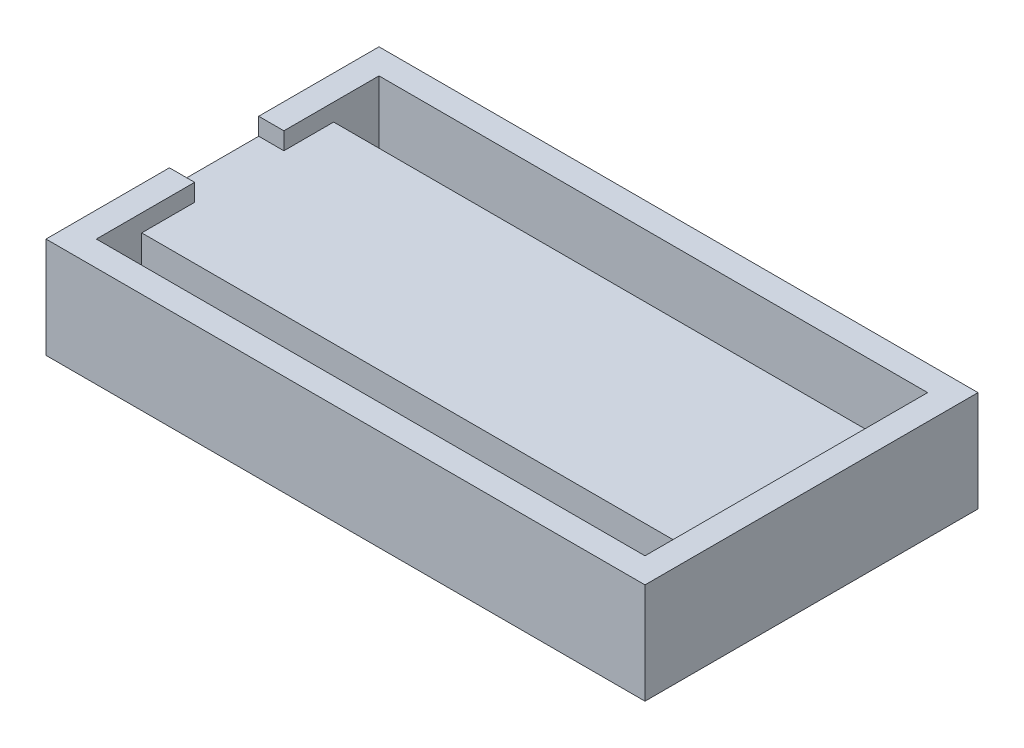
from build123d import *

# Parameters (mm, degrees)
SKETCH1_W           = 59.45
SKETCH1_H           = 33.05
BOSS_EXTRUDE1_DEPTH = 10
CUT_EXTRUDE1_DEPTH  = 1.72
SKETCH3_W           = 54.45
SKETCH3_H           = 4.5
CUT_EXTRUDE2_DEPTH  = 9.2


with BuildPart() as part:
    # Sketch1 → Boss-Extrude1 (new body)
    with BuildSketch(Plane(origin=(0, 0, 0), x_dir=(1, 0, 0), z_dir=(0, 1, 0))):
        Rectangle(SKETCH1_W, SKETCH1_H)
    extrude(amount=BOSS_EXTRUDE1_DEPTH)

    # Sketch2 → Cut-Extrude1 (cut)
    with BuildSketch(Plane(origin=(0, 10, 0), x_dir=(1, 0, 0), z_dir=(0, 1, 0))):
        Polygon((-27.225, -4.275), (-29.72540031, -4.275), (-29.725, 4.584999991), (-27.225, 4.584999991), (-27.225, 14.025), (27.225, 14.025), (27.225, -14.025), (-27.225, -14.025), align=None)
    extrude(amount=-CUT_EXTRUDE1_DEPTH, mode=Mode.SUBTRACT)

    # Sketch3 → Cut-Extrude2 (cut)
    with BuildSketch(Plane(origin=(0, 8.28, 0), x_dir=(1, 0, 0), z_dir=(0, 1, 0))):
        with Locations((0, 11.775)):
            Rectangle(SKETCH3_W, SKETCH3_H)
        with Locations((0, -11.775)):
            Rectangle(SKETCH3_W, SKETCH3_H)
    extrude(amount=-CUT_EXTRUDE2_DEPTH, mode=Mode.SUBTRACT)


solid = part.part
